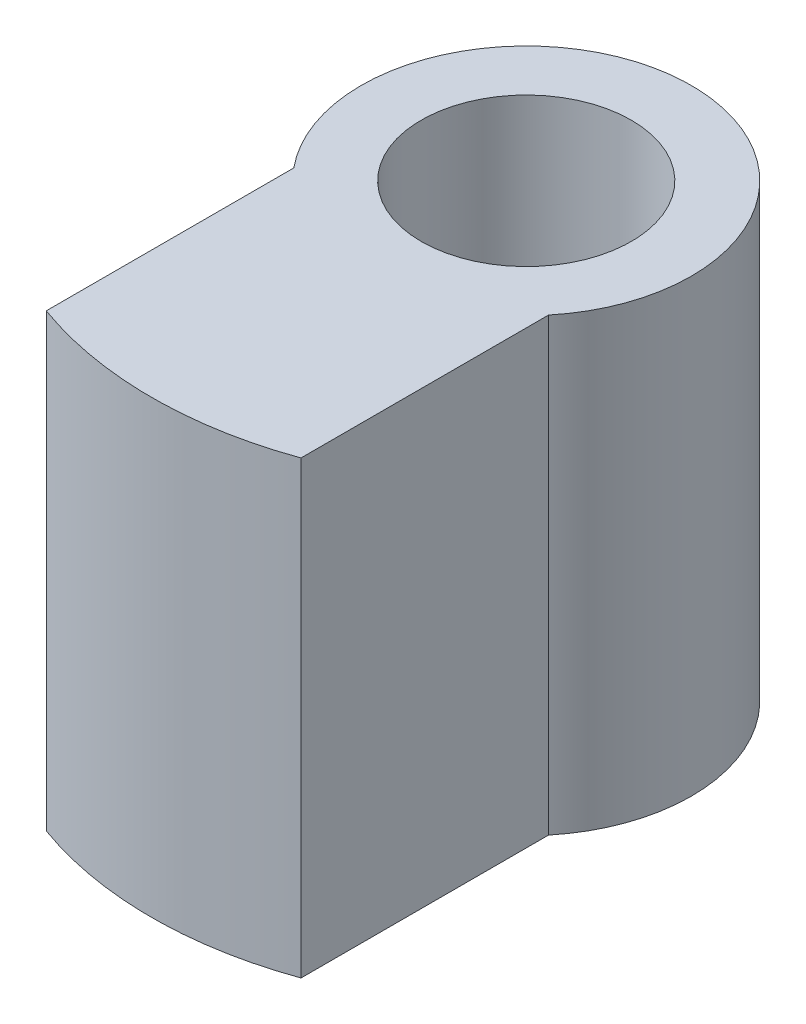
from build123d import *

# Parameters (mm, degrees)
SKETCH1_R           = 3.5
BOSS_EXTRUDE1_DEPTH = 15


with BuildPart() as part:
    # Sketch1 → Boss-Extrude1 (new body)
    with BuildSketch(Plane(origin=(0, 0, 0), x_dir=(1, 0, 0), z_dir=(0, 1, 0))):
        with BuildLine():
            Line((-4.242640687, -3.5), (-4.242640687, -11.743723008))
            ThreePointArc((-4.242640687, -11.743723008), (0, -12.486594014), (4.242640687, -11.743723008))
            Line((4.242640687, -11.743723008), (4.242640687, -3.5))
            ThreePointArc((4.242640687, -3.5), (0, 5.5), (-4.242640687, -3.5))
        make_face()
        with Locations(Location((0, 0, 0), (0, 0, 270))):
            Circle(SKETCH1_R, mode=Mode.SUBTRACT)
    extrude(amount=BOSS_EXTRUDE1_DEPTH)


solid = part.part
